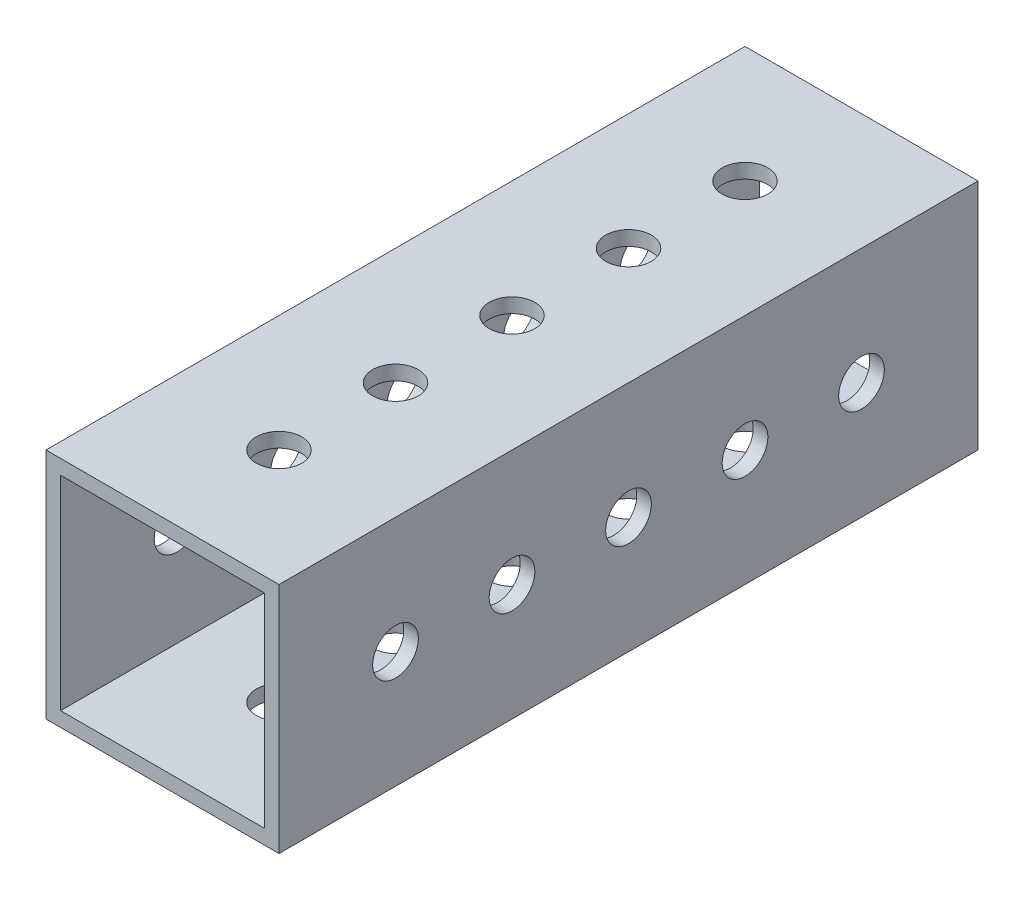
from build123d import *

# Parameters (mm, degrees)
SKETCH1_W               = 25.4
SKETCH1_H               = 25.4
BOSS_EXTRUDE1_DEPTH     = 38.1
SHELL1_T                = -1.5875
CUT_EXTRUDE1_DEPTH      = 43.121134838
CUT_EXTRUDE1_DEPTH_BACK = 43.121134838
SKETCH2_R               = 2.4892
SKETCH3_R               = 2.4892
CUT_EXTRUDE2_DEPTH      = 48.519048812


with BuildPart() as part:
    # Sketch1 → Boss-Extrude1 (new, symmetric)
    with BuildSketch(Plane.XY):
        Rectangle(SKETCH1_W, SKETCH1_H)
    extrude(amount=BOSS_EXTRUDE1_DEPTH, both=True)

    # Shell1
    shell1_openings = [part.faces().sort_by_distance(p)[0] for p in [
        (0, 0, 38.1),
        (0, 0, -38.1),
    ]]
    offset(amount=SHELL1_T, openings=shell1_openings, kind=Kind.INTERSECTION)

    # Sketch2 → Cut-Extrude1 (cut, two sides: drawn at the far end of the back side and taken through both)
    with BuildSketch(Plane(origin=(0, 0, 0), x_dir=(1, 0, 0), z_dir=(0, 1, 0)).offset(-CUT_EXTRUDE1_DEPTH_BACK)):
        with Locations(Location((0, -25.4, 0), (0, 0, 270))):
            Circle(SKETCH2_R)
        with Locations(Location((0, -12.7, 0), (0, 0, 270))):
            Circle(SKETCH2_R)
        with Locations(Location((0, 0, 0), (0, 0, 270))):
            Circle(SKETCH2_R)
        with Locations(Location((0, 12.7, 0), (0, 0, 270))):
            Circle(SKETCH2_R)
        with Locations(Location((0, 25.4, 0), (0, 0, 270))):
            Circle(SKETCH2_R)
    extrude(amount=CUT_EXTRUDE1_DEPTH + CUT_EXTRUDE1_DEPTH_BACK, mode=Mode.SUBTRACT)

    # Sketch3 → Cut-Extrude2 (cut, through all)
    with BuildSketch(Plane.ZY.offset(12.7)):
        with Locations((-25.4, 0)):
            Circle(SKETCH3_R)
        with Locations((-12.7, 0)):
            Circle(SKETCH3_R)
        Circle(SKETCH3_R)
        with Locations((12.7, 0)):
            Circle(SKETCH3_R)
        with Locations((25.4, 0)):
            Circle(SKETCH3_R)
    extrude(amount=-CUT_EXTRUDE2_DEPTH, mode=Mode.SUBTRACT)


solid = part.part
